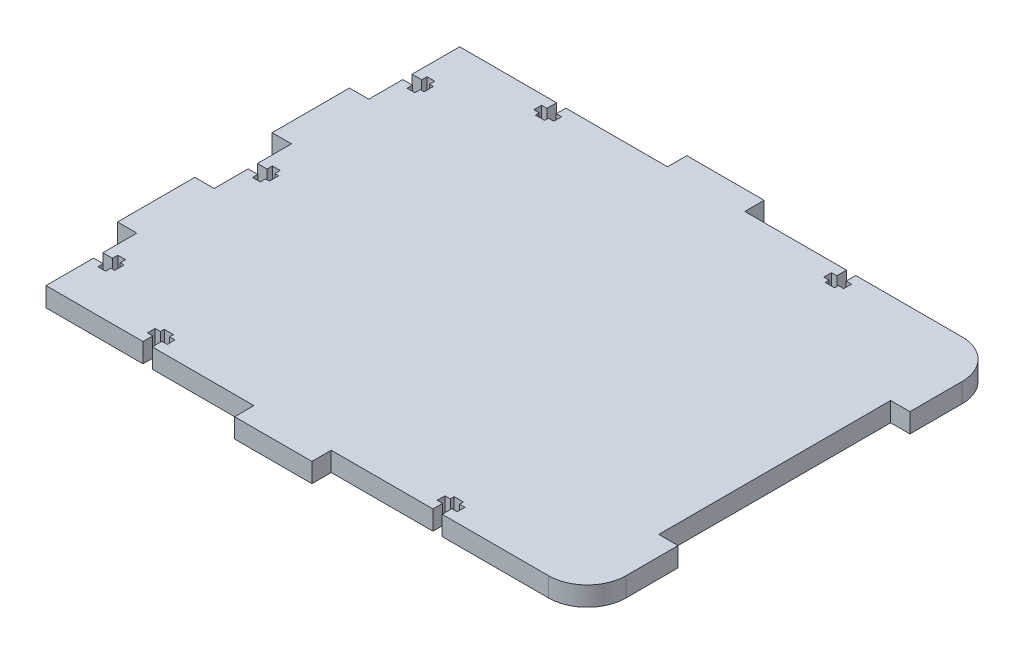
from build123d import *

# Parameters (mm, degrees)
BOSS_EXTRUDE1_DEPTH = 6.35


with BuildPart() as part:
    # Sketch1 → Boss-Extrude1 (new body)
    with BuildSketch(Plane(origin=(0, 0, 0), x_dir=(1, 0, 0), z_dir=(0, 1, 0))):
        with BuildLine():
            Line((-85.499768134, 67.575454856), (-53.631298012, 67.575454856))
            Line((-53.631298012, 67.575454856), (-53.631298012, 64.400454856))
            Line((-53.631298012, 64.400454856), (-55.383898012, 64.400454856))
            Line((-55.383898012, 64.400454856), (-55.383898012, 61.860454856))
            Line((-55.383898012, 61.860454856), (-53.631298012, 61.860454856))
            Line((-53.631298012, 61.860454856), (-53.631298012, 60.590454856))
            Line((-53.631298012, 60.590454856), (-50.583438656, 60.590454856))
            Line((-50.583438656, 60.590454856), (-50.583438656, 61.860454856))
            Line((-50.583438656, 61.860454856), (-48.830838656, 61.860454856))
            Line((-48.830838656, 61.860454856), (-48.830838656, 64.400454856))
            Line((-48.830838656, 64.400454856), (-50.583438656, 64.400454856))
            Line((-50.583438656, 64.400454856), (-50.583438656, 67.575454856))
            Line((-50.583438656, 67.575454856), (-17.182368334, 67.575454856))
            Line((-17.182368334, 67.575454856), (-17.182368334, 73.925454856))
            Line((-17.182368334, 73.925454856), (8.217631666, 73.925454856))
            Line((8.217631666, 73.925454856), (8.217631666, 67.575454856))
            Line((8.217631666, 67.575454856), (41.618701988, 67.575454856))
            Line((41.618701988, 67.575454856), (41.618701988, 64.400454856))
            Line((41.618701988, 64.400454856), (39.866101988, 64.400454856))
            Line((39.866101988, 64.400454856), (39.866101988, 61.860454856))
            Line((39.866101988, 61.860454856), (41.618701988, 61.860454856))
            Line((41.618701988, 61.860454856), (41.618701988, 60.590454856))
            Line((41.618701988, 60.590454856), (44.666561344, 60.590454856))
            Line((44.666561344, 60.590454856), (44.666561344, 61.860454856))
            Line((44.666561344, 61.860454856), (46.419161344, 61.860454856))
            Line((46.419161344, 61.860454856), (46.419161344, 64.400454856))
            Line((46.419161344, 64.400454856), (44.666561344, 64.400454856))
            Line((44.666561344, 64.400454856), (44.666561344, 67.575454856))
            Line((44.666561344, 67.575454856), (79.600231866, 67.575454856))
            ThreePointArc((79.600231866, 67.575454856), (88.580487987, 63.855710977), (92.300231866, 54.875454856))
            Line((92.300231866, 54.875454856), (92.306789937, 37.730454856))
            Line((92.306789937, 37.730454856), (85.971363429, 37.730454856))
            Line((85.971363429, 37.730454856), (85.971363429, -38.469545144))
            Line((85.971363429, -38.469545144), (92.321363429, -38.469545144))
            Line((92.321363429, -38.469545144), (92.342494993, -55.614545144))
            ThreePointArc((92.342494993, -55.614545144), (88.622751114, -64.594801265), (79.642494993, -68.314545144))
            Line((79.642494993, -68.314545144), (44.666561344, -68.314545144))
            Line((44.666561344, -68.314545144), (44.666561344, -65.139545144))
            Line((44.666561344, -65.139545144), (46.419161344, -65.139545144))
            Line((46.419161344, -65.139545144), (46.419161344, -62.599545144))
            Line((46.419161344, -62.599545144), (44.666561344, -62.599545144))
            Line((44.666561344, -62.599545144), (44.666561344, -61.329545144))
            Line((44.666561344, -61.329545144), (41.618701988, -61.329545144))
            Line((41.618701988, -61.329545144), (41.618701988, -62.599545144))
            Line((41.618701988, -62.599545144), (39.866101988, -62.599545144))
            Line((39.866101988, -62.599545144), (39.866101988, -65.139545144))
            Line((39.866101988, -65.139545144), (41.618701988, -65.139545144))
            Line((41.618701988, -65.139545144), (41.618701988, -68.314545144))
            Line((41.618701988, -68.314545144), (8.217631666, -68.314545144))
            Line((8.217631666, -68.314545144), (8.217631666, -74.664545144))
            Line((8.217631666, -74.664545144), (-17.182368334, -74.664545144))
            Line((-17.182368334, -74.664545144), (-17.182368334, -68.314545144))
            Line((-17.182368334, -68.314545144), (-50.583438656, -68.314545144))
            Line((-50.583438656, -68.314545144), (-50.583438656, -65.139545144))
            Line((-50.583438656, -65.139545144), (-48.830838656, -65.139545144))
            Line((-48.830838656, -65.139545144), (-48.830838656, -62.599545144))
            Line((-48.830838656, -62.599545144), (-50.583438656, -62.599545144))
            Line((-50.583438656, -62.599545144), (-50.583438656, -61.329545144))
            Line((-50.583438656, -61.329545144), (-53.631298012, -61.329545144))
            Line((-53.631298012, -61.329545144), (-53.631298012, -62.599545144))
            Line((-53.631298012, -62.599545144), (-55.383898012, -62.599545144))
            Line((-55.383898012, -62.599545144), (-55.383898012, -65.139545144))
            Line((-55.383898012, -65.139545144), (-53.631298012, -65.139545144))
            Line((-53.631298012, -65.139545144), (-53.631298012, -68.314545144))
            Line((-53.631298012, -68.314545144), (-85.499768134, -68.314545144))
            Line((-85.499768134, -68.314545144), (-85.499768134, -52.693474822))
            Line((-85.499768134, -52.693474822), (-82.324768134, -52.693474822))
            Line((-82.324768134, -52.693474822), (-82.324768134, -54.446074822))
            Line((-82.324768134, -54.446074822), (-79.784768134, -54.446074822))
            Line((-79.784768134, -54.446074822), (-79.784768134, -52.693474822))
            Line((-79.784768134, -52.693474822), (-78.514768134, -52.693474822))
            Line((-78.514768134, -52.693474822), (-78.514768134, -49.645615466))
            Line((-78.514768134, -49.645615466), (-79.784768134, -49.645615466))
            Line((-79.784768134, -49.645615466), (-79.784768134, -47.893015466))
            Line((-79.784768134, -47.893015466), (-82.324768134, -47.893015466))
            Line((-82.324768134, -47.893015466), (-82.324768134, -49.645615466))
            Line((-82.324768134, -49.645615466), (-85.499768134, -49.645615466))
            Line((-85.499768134, -49.645615466), (-85.499768134, -38.469545144))
            Line((-85.499768134, -38.469545144), (-91.849768134, -38.469545144))
            Line((-91.849768134, -38.469545144), (-91.849768134, -13.069545144))
            Line((-91.849768134, -13.069545144), (-85.499768134, -13.069545144))
            Line((-85.499768134, -13.069545144), (-85.499768134, -1.893474822))
            Line((-85.499768134, -1.893474822), (-82.324768134, -1.893474822))
            Line((-82.324768134, -1.893474822), (-82.324768134, -3.646074822))
            Line((-82.324768134, -3.646074822), (-79.784768134, -3.646074822))
            Line((-79.784768134, -3.646074822), (-79.784768134, -1.893474822))
            Line((-79.784768134, -1.893474822), (-78.514768134, -1.893474822))
            Line((-78.514768134, -1.893474822), (-78.514768134, 1.154384534))
            Line((-78.514768134, 1.154384534), (-79.784768134, 1.154384534))
            Line((-79.784768134, 1.154384534), (-79.784768134, 2.906984534))
            Line((-79.784768134, 2.906984534), (-82.324768134, 2.906984534))
            Line((-82.324768134, 2.906984534), (-82.324768134, 1.154384534))
            Line((-82.324768134, 1.154384534), (-85.499768134, 1.154384534))
            Line((-85.499768134, 1.154384534), (-85.499768134, 12.330454856))
            Line((-85.499768134, 12.330454856), (-91.849768134, 12.330454856))
            Line((-91.849768134, 12.330454856), (-91.849768134, 37.730454856))
            Line((-91.849768134, 37.730454856), (-85.499768134, 37.730454856))
            Line((-85.499768134, 37.730454856), (-85.499768134, 48.906525178))
            Line((-85.499768134, 48.906525178), (-82.324768134, 48.906525178))
            Line((-82.324768134, 48.906525178), (-82.324768134, 47.153925178))
            Line((-82.324768134, 47.153925178), (-79.784768134, 47.153925178))
            Line((-79.784768134, 47.153925178), (-79.784768134, 48.906525178))
            Line((-79.784768134, 48.906525178), (-78.514768134, 48.906525178))
            Line((-78.514768134, 48.906525178), (-78.514768134, 51.954384534))
            Line((-78.514768134, 51.954384534), (-79.784768134, 51.954384534))
            Line((-79.784768134, 51.954384534), (-79.784768134, 53.706984534))
            Line((-79.784768134, 53.706984534), (-82.324768134, 53.706984534))
            Line((-82.324768134, 53.706984534), (-82.324768134, 51.954384534))
            Line((-82.324768134, 51.954384534), (-85.499768134, 51.954384534))
            Line((-85.499768134, 51.954384534), (-85.499768134, 67.575454856))
        make_face()
    extrude(amount=BOSS_EXTRUDE1_DEPTH)


solid = part.part
